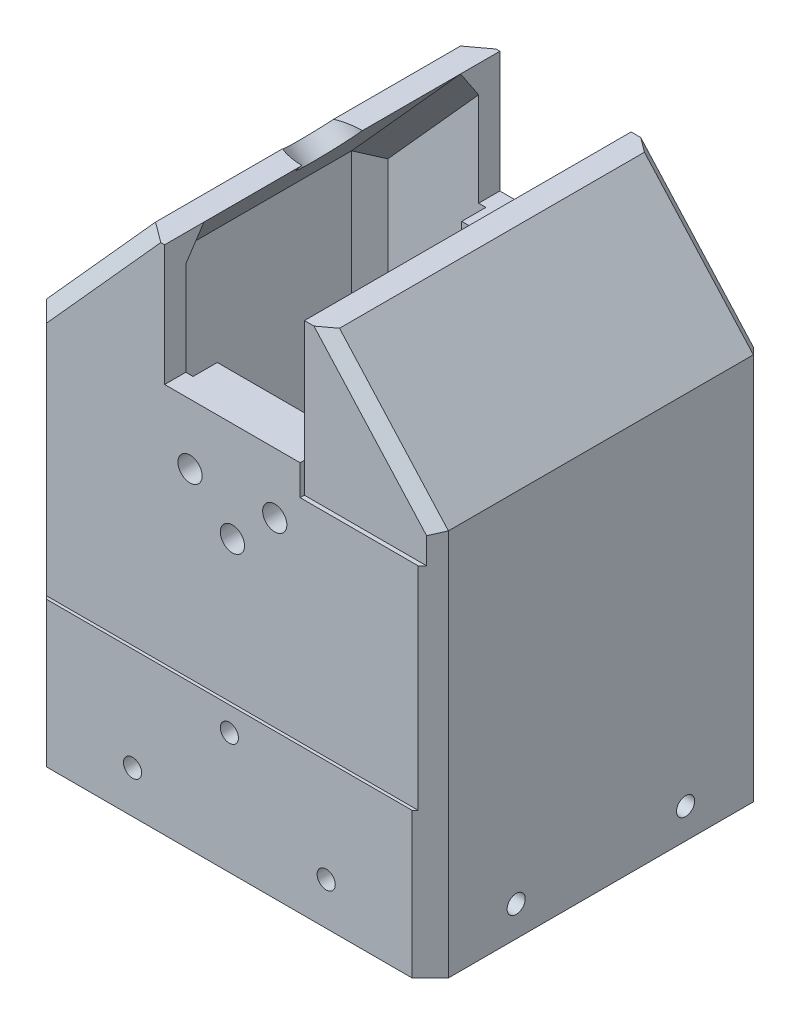
from build123d import *

# Parameters (mm, degrees)
SKETCH_1_W           = 66.4
SKETCH_1_H           = 56.4
EXTRUDE_1_DEPTH      = 64
EXTRUDE_2_DEPTH      = 4
EXTRUDE_3_DEPTH      = 4
EXTRUDE_4_REACH      = 106.422
SKETCH_8_W           = 4
SKETCH_8_H           = 45
CUT_EXTRUDE_5_DEPTH  = 10
SKETCH_9_R           = 1.5
CUT_EXTRUDE_6_DEPTH  = 111.725787421
SKETCH_11_R          = 1.5
CUT_EXTRUDE_8_DEPTH  = 107.485679788
CHAMFER_1_SIZE       = 3
CUT_EXTRUDE_9_REACH  = 104.473
SKETCH_7_R           = 0.75
SKETCH_12_R          = 2
CUT_EXTRUDE_10_DEPTH = 5
CUT_EXTRUDE_11_REACH = 108.486
SKETCH_13_R          = 0.75
SKETCH_14_R          = 2
CUT_EXTRUDE_12_DEPTH = 5
SKETCH_16_W          = 0.5
SKETCH_16_H          = 60
CUT_EXTRUDE_16_DEPTH = 111.725787421
SKETCH_17_W          = 0.7
SKETCH_17_H          = 25
CUT_EXTRUDE_17_DEPTH = 22
CUT_EXTRUDE_18_DEPTH = 10


with BuildPart() as part:
    # 草图1 → 凸台-拉伸1 (new body)
    with BuildSketch(Plane(origin=(0, 0, 0), x_dir=(1, 0, 0), z_dir=(0, 1, 0))):
        Rectangle(SKETCH_1_W, SKETCH_1_H)
        Polygon((29.2, 24.2), (10, 24.2), (10, 20.2), (-10, 20.2), (-10, 24.2), (-29.2, 24.2), (-29.2, -24.2), (-10, -24.2), (-10, -20.2), (10, -20.2), (10, -24.2), (29.2, -24.2), align=None, mode=Mode.SUBTRACT)
    extrude(amount=EXTRUDE_1_DEPTH)

    # 草图3 → 凸台-拉伸2 (add)
    with BuildSketch(Plane.XY.offset(28.2)):
        Polygon((-33.2, 64), (-11.2, 64), (-11.2, 84), (-15.2, 84), align=None)
        Polygon((33.2, 64), (11.2, 64), (11.2, 84), (15.2, 84), align=None)
    extrude(amount=-EXTRUDE_2_DEPTH)

    # 草图4 → 凸台-拉伸3 (add)
    with BuildSketch(Plane(origin=(0, 0, -28.2), x_dir=(-1, 0, 0), z_dir=(0, 0, -1))):
        Polygon((-33.2, 64), (-11.2, 64), (-11.2, 84), (-15.2, 84), align=None)
        Polygon((33.2, 64), (11.2, 64), (11.2, 84), (15.2, 84), align=None)
    extrude(amount=-EXTRUDE_3_DEPTH)

    # 草图5 → 凸台-拉伸4 (add, up to next)
    with BuildSketch(Plane.XY.offset(-24.2), mode=Mode.PRIVATE) as extrude_4_sk1:
        Polygon((-29.2, 64), (-33.2, 64), (-15.2, 84), (-11.2, 84), align=None)
    extrude_4_tool1 = extrude(extrude_4_sk1.sketch, amount=EXTRUDE_4_REACH, mode=Mode.PRIVATE) - part.part
    # 草图5 → 凸台-拉伸4 (add, up to next)
    with BuildSketch(Plane.XY.offset(-24.2), mode=Mode.PRIVATE) as extrude_4_sk2:
        Polygon((11.2, 84), (29.2, 64), (33.2, 64), (15.2, 84), align=None)
    extrude_4_tool2 = extrude(extrude_4_sk2.sketch, amount=EXTRUDE_4_REACH, mode=Mode.PRIVATE) - part.part
    add(extrude_4_tool1.solids().sort_by_distance((-22.2, 74, -24.2))[0])
    add(extrude_4_tool2.solids().sort_by_distance((22.2, 74, -24.2))[0])

    # 草图8 → 切除-拉伸5 (cut, symmetric)
    with BuildSketch(Plane(origin=(0, 0, 0), x_dir=(0, 0, -1), z_dir=(1, 0, 0))):
        with Locations((-22.2, 22.5)):
            Rectangle(SKETCH_8_W, SKETCH_8_H)
        with Locations((22.2, 22.5)):
            Rectangle(SKETCH_8_W, SKETCH_8_H)
    extrude(amount=CUT_EXTRUDE_5_DEPTH, both=True, mode=Mode.SUBTRACT)

    # 草图9 → 切除-拉伸6 (cut, through all)
    with BuildSketch(Plane.ZY.offset(33.2)):
        with Locations((14, 5)):
            Circle(SKETCH_9_R)
        with Locations((-14, 5)):
            Circle(SKETCH_9_R)
    extrude(amount=-CUT_EXTRUDE_6_DEPTH, mode=Mode.SUBTRACT)

    # 草图11 → 切除-拉伸8 (cut, through all)
    with BuildSketch(Plane.XY.offset(28.2)):
        with Locations((0, 20)):
            Circle(SKETCH_11_R)
        with Locations((-16, 7)):
            Circle(SKETCH_11_R)
        with Locations((16, 7)):
            Circle(SKETCH_11_R)
    extrude(amount=-CUT_EXTRUDE_8_DEPTH, mode=Mode.SUBTRACT)

    # 倒角1
    chamfer_1_edges = [part.edges().sort_by_distance(p)[0] for p in [
        (-20.2, 74, 24.2),
        (-29.2, 32, 24.2),
        (-20.2, 74, -24.2),
        (-29.2, 32, -24.2),
        (20.2, 74, 24.2),
        (29.2, 32, 24.2),
        (20.2, 74, -24.2),
        (29.2, 32, -24.2),
        (-24.2, 74, 28.2),
        (-24.2, 74, -28.2),
        (-33.2, 32, 28.2),
        (-33.2, 32, -28.2),
        (24.2, 74, 28.2),
        (24.2, 74, -28.2),
        (33.2, 32, -28.2),
        (33.2, 32, 28.2),
    ]]
    chamfer(chamfer_1_edges, length=CHAMFER_1_SIZE)

    # 草图7 → 切除-拉伸9 (cut, up to next)
    with BuildSketch(Plane(origin=(0, 0, 20.2), x_dir=(-1, 0, 0), z_dir=(0, 0, -1)), mode=Mode.PRIVATE) as cut_extrude_9_sk1:
        with Locations((0, 47.5)):
            Circle(SKETCH_7_R)
    cut_extrude_9_tool1 = extrude(cut_extrude_9_sk1.sketch, amount=-CUT_EXTRUDE_9_REACH, mode=Mode.PRIVATE) & part.part
    # 草图7 → 切除-拉伸9 (cut, up to next)
    with BuildSketch(Plane(origin=(0, 0, 20.2), x_dir=(-1, 0, 0), z_dir=(0, 0, -1)), mode=Mode.PRIVATE) as cut_extrude_9_sk2:
        with Locations((-7, 54)):
            Circle(SKETCH_7_R)
    cut_extrude_9_tool2 = extrude(cut_extrude_9_sk2.sketch, amount=-CUT_EXTRUDE_9_REACH, mode=Mode.PRIVATE) & part.part
    # 草图7 → 切除-拉伸9 (cut, up to next)
    with BuildSketch(Plane(origin=(0, 0, 20.2), x_dir=(-1, 0, 0), z_dir=(0, 0, -1)), mode=Mode.PRIVATE) as cut_extrude_9_sk3:
        with Locations((7, 54)):
            Circle(SKETCH_7_R)
    cut_extrude_9_tool3 = extrude(cut_extrude_9_sk3.sketch, amount=-CUT_EXTRUDE_9_REACH, mode=Mode.PRIVATE) & part.part
    add(cut_extrude_9_tool1.solids().sort_by_distance((0, 47.5, 20.2))[0], mode=Mode.SUBTRACT)
    add(cut_extrude_9_tool2.solids().sort_by_distance((7, 54, 20.2))[0], mode=Mode.SUBTRACT)
    add(cut_extrude_9_tool3.solids().sort_by_distance((-7, 54, 20.2))[0], mode=Mode.SUBTRACT)

    # 草图12 → 切除-拉伸10 (cut)
    with BuildSketch(Plane.XY.offset(28.2)):
        with Locations((-7, 54)):
            Circle(SKETCH_12_R)
        with Locations((7, 54)):
            Circle(SKETCH_12_R)
        with Locations((0, 47.5)):
            Circle(SKETCH_12_R)
    extrude(amount=-CUT_EXTRUDE_10_DEPTH, mode=Mode.SUBTRACT)

    # 草图13 → 切除-拉伸11 (cut, up to next)
    with BuildSketch(Plane(origin=(0, 0, -28.2), x_dir=(-1, 0, 0), z_dir=(0, 0, -1)), mode=Mode.PRIVATE) as cut_extrude_11_sk1:
        with Locations((-7.6, 47.4)):
            Circle(SKETCH_13_R)
    cut_extrude_11_tool1 = extrude(cut_extrude_11_sk1.sketch, amount=-CUT_EXTRUDE_11_REACH, mode=Mode.PRIVATE) & part.part
    # 草图13 → 切除-拉伸11 (cut, up to next)
    with BuildSketch(Plane(origin=(0, 0, -28.2), x_dir=(-1, 0, 0), z_dir=(0, 0, -1)), mode=Mode.PRIVATE) as cut_extrude_11_sk2:
        with Locations((-7.6, 60.8)):
            Circle(SKETCH_13_R)
    cut_extrude_11_tool2 = extrude(cut_extrude_11_sk2.sketch, amount=-CUT_EXTRUDE_11_REACH, mode=Mode.PRIVATE) & part.part
    # 草图13 → 切除-拉伸11 (cut, up to next)
    with BuildSketch(Plane(origin=(0, 0, -28.2), x_dir=(-1, 0, 0), z_dir=(0, 0, -1)), mode=Mode.PRIVATE) as cut_extrude_11_sk3:
        with Locations((7.6, 60.8)):
            Circle(SKETCH_13_R)
    cut_extrude_11_tool3 = extrude(cut_extrude_11_sk3.sketch, amount=-CUT_EXTRUDE_11_REACH, mode=Mode.PRIVATE) & part.part
    # 草图13 → 切除-拉伸11 (cut, up to next)
    with BuildSketch(Plane(origin=(0, 0, -28.2), x_dir=(-1, 0, 0), z_dir=(0, 0, -1)), mode=Mode.PRIVATE) as cut_extrude_11_sk4:
        with Locations((7.6, 47.4)):
            Circle(SKETCH_13_R)
    cut_extrude_11_tool4 = extrude(cut_extrude_11_sk4.sketch, amount=-CUT_EXTRUDE_11_REACH, mode=Mode.PRIVATE) & part.part
    add(cut_extrude_11_tool1.solids().sort_by_distance((7.6, 47.4, -28.2))[0], mode=Mode.SUBTRACT)
    add(cut_extrude_11_tool2.solids().sort_by_distance((7.6, 60.8, -28.2))[0], mode=Mode.SUBTRACT)
    add(cut_extrude_11_tool3.solids().sort_by_distance((-7.6, 60.8, -28.2))[0], mode=Mode.SUBTRACT)
    add(cut_extrude_11_tool4.solids().sort_by_distance((-7.6, 47.4, -28.2))[0], mode=Mode.SUBTRACT)

    # 草图14 → 切除-拉伸12 (cut)
    with BuildSketch(Plane(origin=(0, 0, -28.2), x_dir=(-1, 0, 0), z_dir=(0, 0, -1))):
        with Locations((-7.6, 60.8)):
            Circle(SKETCH_14_R)
        with Locations((7.6, 60.8)):
            Circle(SKETCH_14_R)
        with Locations((-7.6, 47.4)):
            Circle(SKETCH_14_R)
        with Locations((7.6, 47.4)):
            Circle(SKETCH_14_R)
    extrude(amount=-CUT_EXTRUDE_12_DEPTH, mode=Mode.SUBTRACT)

    # 草图16 → 切除-拉伸16 (cut, through all)
    with BuildSketch(Plane(origin=(33.2, 0, 0), x_dir=(0, 0, -1), z_dir=(1, 0, 0))):
        with Locations((-27.95, 54)):
            Rectangle(SKETCH_16_W, SKETCH_16_H)
        with Locations((27.95, 54)):
            Rectangle(SKETCH_16_W, SKETCH_16_H)
    extrude(amount=-CUT_EXTRUDE_16_DEPTH, mode=Mode.SUBTRACT)

    # 草图17 → 切除-拉伸17 (cut)
    with BuildSketch(Plane(origin=(33.2, 0, 0), x_dir=(0, 0, -1), z_dir=(1, 0, 0))):
        with Locations((-27.35, 71.5)):
            Rectangle(SKETCH_17_W, SKETCH_17_H)
        with Locations((27.35, 71.5)):
            Rectangle(SKETCH_17_W, SKETCH_17_H)
    extrude(amount=-CUT_EXTRUDE_17_DEPTH, mode=Mode.SUBTRACT)

    # 草图18 → 切除-拉伸18 (cut)
    with BuildSketch(Plane(origin=(-50.165745856, 45.149171271, 0), x_dir=(0, 0, 1), z_dir=(-0.743294146247166, 0.6689647316224501, 0))):
        with BuildLine():
            Line((-5, 54.944303291), (5, 54.944303291))
            ThreePointArc((5, 54.944303291), (0, 49.944303291), (-5, 54.944303291))
        make_face()
    extrude(amount=-CUT_EXTRUDE_18_DEPTH, mode=Mode.SUBTRACT)


solid = part.part
